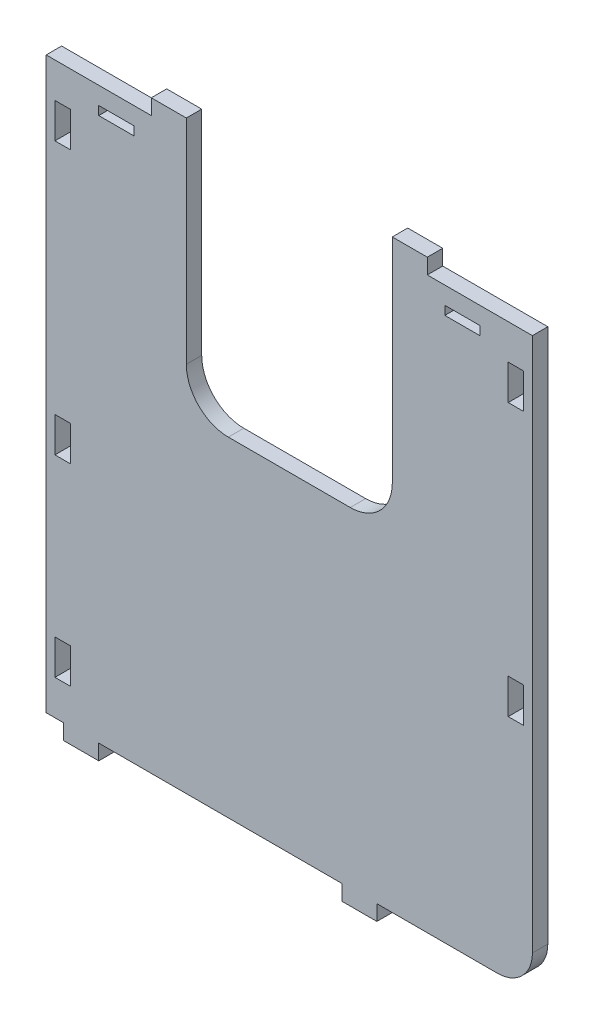
from build123d import *

# Parameters (mm, degrees)
BOSS_EXTRUDE1_DEPTH = 2.794
FILLET1_R           = 7.62
SKETCH2_W           = 6.35
SKETCH2_H           = 1.5875
SKETCH2_W_2         = 2.794
SKETCH2_H_2         = 6.35
CUT_EXTRUDE1_DEPTH  = 127.827697441
FILLET2_R           = 6.35


with BuildPart() as part:
    # Sketch1 → Boss-Extrude1 (new body)
    with BuildSketch(Plane.XY):
        Polygon((18.662640042, 103.275), (-0.387359958, 103.275), (-0.387359958, 106.069), (-6.737359958, 106.069), (-6.737359958, 59.782284891), (-44.075359958, 59.782284891), (-44.075359958, 106.069), (-50.425359958, 106.069), (-50.425359958, 103.275), (-69.475359958, 103.275), (-69.475359958, 0), (-66.300359958, 0), (-66.300359958, -2.794), (-59.950359958, -2.794), (-59.950359958, 0), (-15.881359958, 0), (-15.881359958, -2.794), (-9.531359958, -2.794), (-9.531359958, 0), (18.662640042, 0), align=None)
    extrude(amount=BOSS_EXTRUDE1_DEPTH)

    # Fillet1
    fillet1_edges = [part.edges().sort_by_distance(p)[0] for p in [
        (-44.075359958, 59.782284891, 1.397),
        (-6.737359958, 59.782284891, 1.397),
    ]]
    fillet(fillet1_edges, radius=FILLET1_R)

    # Sketch2 → Cut-Extrude1 (cut, through all)
    with BuildSketch(Plane.XY.offset(2.794)):
        with Locations((-56.775359958, 99.30625)):
            Rectangle(SKETCH2_W, SKETCH2_H)
        with Locations((5.962640042, 99.30625)):
            Rectangle(SKETCH2_W, SKETCH2_H)
        with Locations((15.678140042, 44.45)):
            Rectangle(SKETCH2_W_2, SKETCH2_H_2)
        with Locations((15.678140042, 93.75)):
            Rectangle(SKETCH2_W_2, SKETCH2_H_2)
        with Locations((-66.490859958, 93.75)):
            Rectangle(SKETCH2_W_2, SKETCH2_H_2)
        with Locations((-66.490859958, 44.45)):
            Rectangle(SKETCH2_W_2, SKETCH2_H_2)
        with Locations((-66.490859958, 9.525)):
            Rectangle(SKETCH2_W_2, SKETCH2_H_2)
    extrude(amount=-CUT_EXTRUDE1_DEPTH, mode=Mode.SUBTRACT)

    # Fillet2
    fillet2_edges = [part.edges().sort_by_distance(p)[0] for p in [
        (18.662640042, 0, 1.397),
    ]]
    fillet(fillet2_edges, radius=FILLET2_R)


solid = part.part
